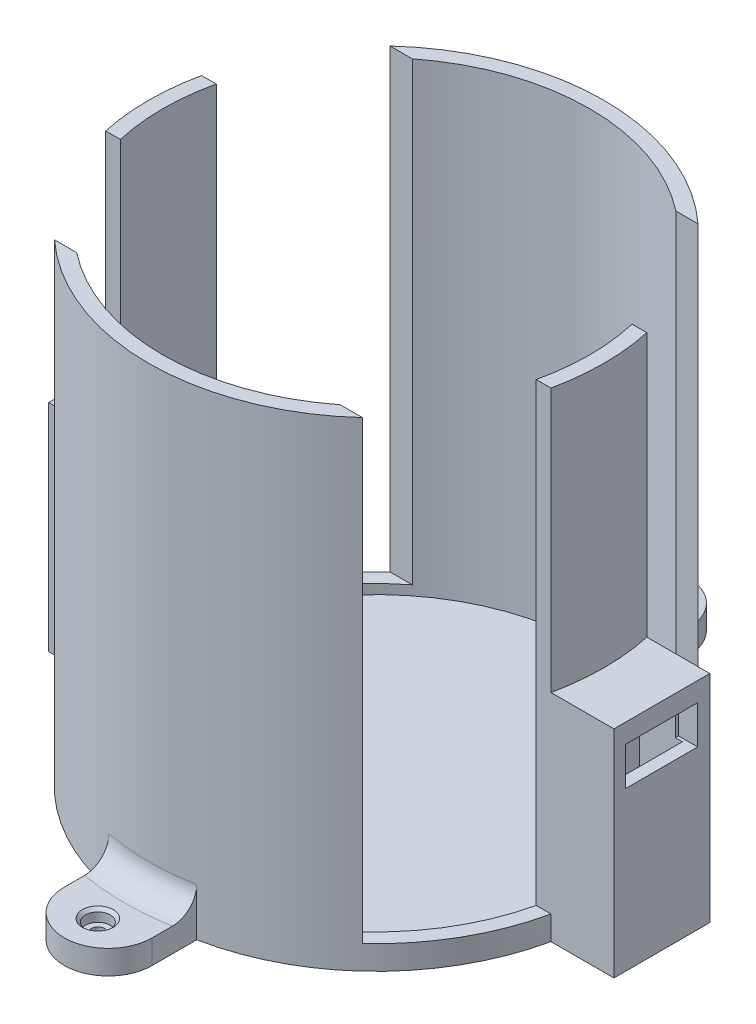
from build123d import *

# Parameters (mm, degrees)
SKETCH2_R                                     = 47.5
BOSS_EXTRUDE2_DEPTH                           = 100
SKETCH3_R                                     = 44.5
CUT_EXTRUDE1_DEPTH                            = 97
SKETCH4_W                                     = 145.572703988
SKETCH4_H                                     = 25
SKETCH4_W_2                                   = 159.095851353
CUT_EXTRUDE3_DEPTH                            = 95
BOSS_EXTRUDE3_DEPTH                           = 5
FILLET1_R                                     = 5
CBORE_FOR_3_SOCKET_HEAD_CAP_SCREW1_AT_2_COUNT = 2
CBORE_FOR_3_SOCKET_HEAD_CAP_SCREW1_AT_2_PITCH = 116.131492307
BOSS_EXTRUDE4_DEPTH                           = 45
SKETCH10_W                                    = 9
SKETCH10_H                                    = 14
CUT_EXTRUDE4_DEPTH                            = 43
SKETCH11_W                                    = 15
SKETCH11_H                                    = 8
CUT_EXTRUDE5_DEPTH                            = 4
SKETCH12_W                                    = 15
SKETCH12_H                                    = 8
CUT_EXTRUDE6_DEPTH                            = 4
CUT_EXTRUDE7_REACH                            = 169.726
CUT_EXTRUDE7_END_RADIUS                       = 44.5
SKETCH13_R                                    = 3.15
CUT_EXTRUDE8_REACH                            = 161.839
CUT_EXTRUDE8_END_RADIUS                       = 44.5
SKETCH14_R                                    = 2.65


with BuildPart() as part:
    # Sketch2 → Boss-Extrude2 (new body)
    with BuildSketch(Plane(origin=(0, 0, 0), x_dir=(1, 0, 0), z_dir=(0, 1, 0))):
        with Locations(Location((0, 0, 0), (0, 0, 270))):
            Circle(SKETCH2_R)
    extrude(amount=BOSS_EXTRUDE2_DEPTH)

    # Sketch3 → Cut-Extrude1 (cut)
    with BuildSketch(Plane(origin=(0, 100, 0), x_dir=(1, 0, 0), z_dir=(0, 1, 0))):
        with Locations(Location((0, 0, 0), (0, 0, 270))):
            Circle(SKETCH3_R)
    extrude(amount=-CUT_EXTRUDE1_DEPTH, mode=Mode.SUBTRACT)

    # Sketch4 → Cut-Extrude3 (cut)
    with BuildSketch(Plane(origin=(0, 100, 0), x_dir=(1, 0, 0), z_dir=(0, 1, 0))):
        with Locations((2.391411924, -22.5)):
            Rectangle(SKETCH4_W, SKETCH4_H)
        with Locations((9.152985607, 22.5)):
            Rectangle(SKETCH4_W_2, SKETCH4_H)
    extrude(amount=-CUT_EXTRUDE3_DEPTH, mode=Mode.SUBTRACT)

    # Sketch5 → Boss-Extrude3 (add)
    with BuildSketch(Plane.XZ):
        with BuildLine():
            Line((-9.162255845, 46.607972149), (-9.162255845, 55.903490308))
            ThreePointArc((-9.162255845, 55.903490308), (0, 65.065746153), (9.162255845, 55.903490308))
            Line((9.162255845, 55.903490308), (9.162255845, 46.607972149))
            ThreePointArc((9.162255845, 46.607972149), (0, 47.5), (-9.162255845, 46.607972149))
        make_face()
        with BuildLine():
            Line((9.162255845, -46.607972149), (9.162255845, -55.903490308))
            ThreePointArc((9.162255845, -55.903490308), (0, -65.065746153), (-9.162255845, -55.903490308))
            Line((-9.162255845, -55.903490308), (-9.162255845, -46.607972149))
            ThreePointArc((-9.162255845, -46.607972149), (0, -47.5), (9.162255845, -46.607972149))
        make_face()
    extrude(amount=-BOSS_EXTRUDE3_DEPTH)

    # Fillet1
    fillet1_edges = [part.edges().sort_by_distance(p)[0] for p in [
        (0, 5, -47.5),
        (4.602788445, 5, 47.276467069),
    ]]
    fillet(fillet1_edges, radius=FILLET1_R)

    # Sketch8 → CBORE for #3 Socket Head Cap Screw1 (revolve, cut)
    with BuildSketch(Plane(origin=(0, 5, 58.065746153), x_dir=(0, 0, 1), z_dir=(1, 0, 0))):
        Polygon((0, 0), (0, 5), (1.397, 5), (1.397, 2.5146), (2.57937, 2.5146), (2.57937, 0.635), (3.21437, 0), align=None)
    cbore_for_3_socket_head_cap_screw1 = revolve(axis=Axis((0, 11.35, 58.065746153), (0, -1, 0)), mode=Mode.SUBTRACT)

    # CBORE for #3 Socket Head Cap Screw1 at 2: CBORE for #3 Socket Head Cap Screw1 ×2
    with Locations(*[(0, 0, -i * CBORE_FOR_3_SOCKET_HEAD_CAP_SCREW1_AT_2_PITCH) for i in range(1, CBORE_FOR_3_SOCKET_HEAD_CAP_SCREW1_AT_2_COUNT)]):
        add(cbore_for_3_socket_head_cap_screw1, mode=Mode.SUBTRACT)

    # Sketch9 → Boss-Extrude4 (add)
    with BuildSketch(Plane.XZ):
        with BuildLine():
            Line((-58.325612467, 10), (-46.435439053, 10))
            ThreePointArc((-46.435439053, 10), (-47.5, 0), (-46.435439053, -10))
            Line((-46.435439053, -10), (-58.325612467, -10))
            Line((-58.325612467, -10), (-58.325612467, 10))
        make_face()
        with BuildLine():
            Line((46.435439053, 10), (59.566582945, 10))
            Line((59.566582945, 10), (59.566582945, -10))
            Line((59.566582945, -10), (46.435439053, -10))
            ThreePointArc((46.435439053, -10), (47.5, 0), (46.435439053, 10))
        make_face()
    extrude(amount=-BOSS_EXTRUDE4_DEPTH)

    # Sketch10 → Cut-Extrude4 (cut)
    with BuildSketch(Plane.XZ):
        with Locations((-51.602219379, 0.189273316)):
            Rectangle(SKETCH10_W, SKETCH10_H)
        with Locations((52.545961871, 0.189273316)):
            Rectangle(SKETCH10_W, SKETCH10_H)
    extrude(amount=-CUT_EXTRUDE4_DEPTH, mode=Mode.SUBTRACT)

    # Sketch11 → Cut-Extrude5 (cut)
    with BuildSketch(Plane(origin=(59.566582945, 0, 0), x_dir=(0, 0, -1), z_dir=(1, 0, 0))):
        with Locations((-0.034463617, 37)):
            Rectangle(SKETCH11_W, SKETCH11_H)
    extrude(amount=-CUT_EXTRUDE5_DEPTH, mode=Mode.SUBTRACT)

    # Sketch12 → Cut-Extrude6 (cut)
    with BuildSketch(Plane.ZY.offset(58.325612467)):
        with Locations((0.376507126, 37)):
            Rectangle(SKETCH12_W, SKETCH12_H)
    extrude(amount=-CUT_EXTRUDE6_DEPTH, mode=Mode.SUBTRACT)

    # Cut-Extrude7: up to this cylinder (the profile starts outside it)
    cut_extrude7_end = Plane(origin=(0, 36.5, 0), z_dir=(0, 1, 0)) * Cylinder(CUT_EXTRUDE7_END_RADIUS, 429.452, mode=Mode.PRIVATE)
    # Sketch13 → Cut-Extrude7 (cut, up to the surface)
    with BuildSketch(Plane.ZY.offset(58.325612467), mode=Mode.PRIVATE) as cut_extrude7_sk1:
        with Locations((0, 36.5)):
            Circle(SKETCH13_R)
    cut_extrude7_tool1 = extrude(cut_extrude7_sk1.sketch, amount=-CUT_EXTRUDE7_REACH, mode=Mode.PRIVATE) - cut_extrude7_end
    add(cut_extrude7_tool1.solids().sort_by_distance((-58.325612, 36.5, 0))[0], mode=Mode.SUBTRACT)

    # Cut-Extrude8: up to this cylinder (the profile starts outside it)
    cut_extrude8_end = Plane(origin=(0, 36.5, 0), z_dir=(0, 1, 0)) * Cylinder(CUT_EXTRUDE8_END_RADIUS, 413.678, mode=Mode.PRIVATE)
    # Sketch14 → Cut-Extrude8 (cut, up to the surface)
    with BuildSketch(Plane(origin=(48.045961871, 0, 0), x_dir=(0, 0, -1), z_dir=(1, 0, 0)), mode=Mode.PRIVATE) as cut_extrude8_sk1:
        with Locations((0, 36.5)):
            Circle(SKETCH14_R)
    cut_extrude8_tool1 = extrude(cut_extrude8_sk1.sketch, amount=-CUT_EXTRUDE8_REACH, mode=Mode.PRIVATE) - cut_extrude8_end
    add(cut_extrude8_tool1.solids().sort_by_distance((48.045962, 36.5, 0))[0], mode=Mode.SUBTRACT)


solid = part.part
